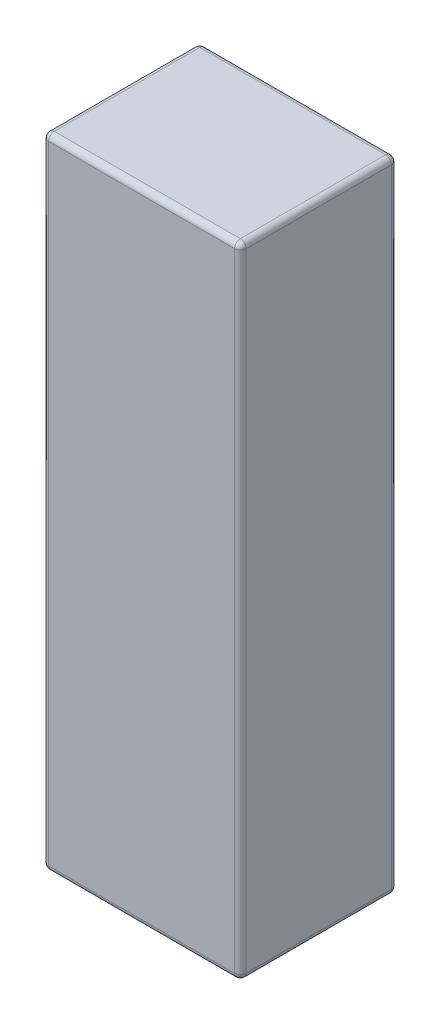
from build123d import *

# Parameters (mm, degrees)
SKIZZE1_W                       = 17
SKIZZE1_H                       = 13.5
AUFSATZ_LINEAR_AUSTRAGEN1_DEPTH = 55
VERRUNDUNG1_R                   = 0.5


with BuildPart() as part:
    # Skizze1 → Aufsatz-Linear austragen1 (new body)
    with BuildSketch(Plane(origin=(0, 0, 0), x_dir=(1, 0, 0), z_dir=(0, 1, 0))):
        Rectangle(SKIZZE1_W, SKIZZE1_H)
    extrude(amount=AUFSATZ_LINEAR_AUSTRAGEN1_DEPTH)

    # Verrundung1
    verrundung1_edges = [part.edges().sort_by_distance(p)[0] for p in [
        (-8.5, 55, 0),
        (0, 55, 6.75),
        (8.5, 55, 0),
        (0, 0, 6.75),
        (-8.5, 0, 0),
        (0, 0, -6.75),
        (8.5, 0, 0),
        (0, 55, -6.75),
        (8.5, 27.5, 6.75),
        (-8.5, 27.5, 6.75),
        (-8.5, 27.5, -6.75),
        (8.5, 27.5, -6.75),
    ]]
    fillet(verrundung1_edges, radius=VERRUNDUNG1_R)


solid = part.part
